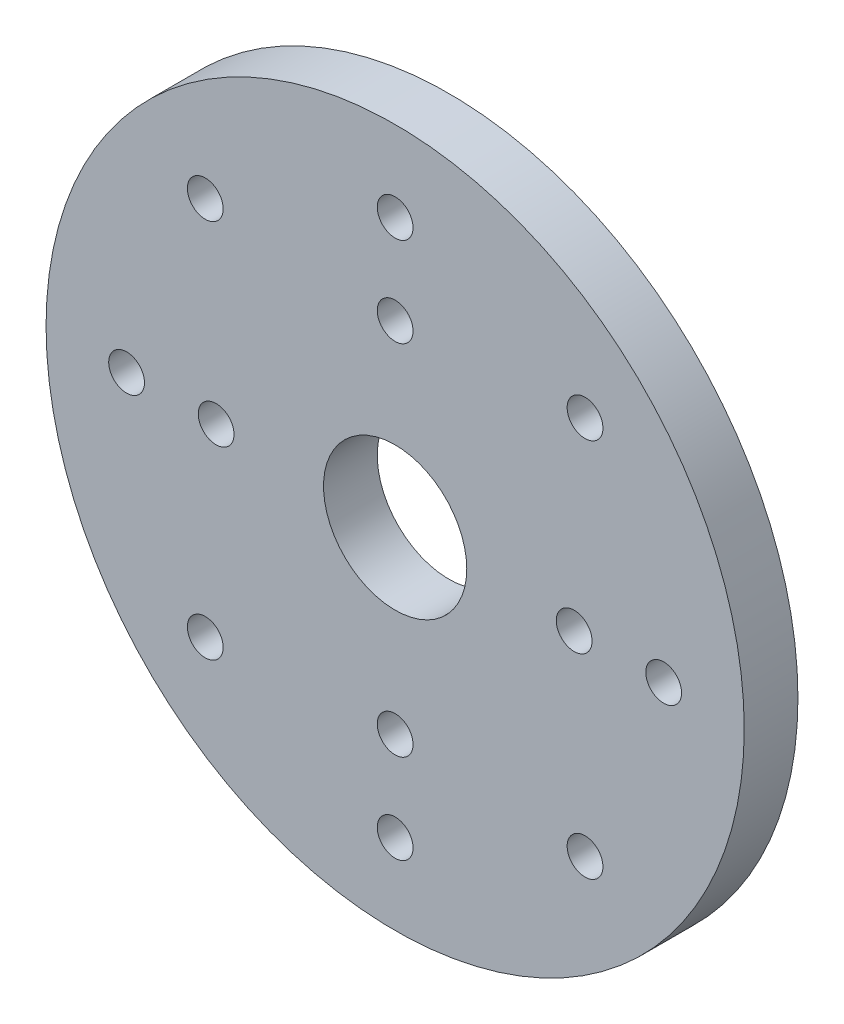
from build123d import *

# Parameters (mm, degrees)
CROQUIS1_R              = 19.5
SALIENTE_EXTRUIR1_DEPTH = 3
CROQUIS2_R              = 1
CORTAR_EXTRUIR1_DEPTH   = 3
CROQUIS3_R              = 4
CORTAR_EXTRUIR2_DEPTH   = 3


with BuildPart() as part:
    # Croquis1 → Saliente-Extruir1 (new body)
    with BuildSketch(Plane.XY):
        Circle(CROQUIS1_R)
    extrude(amount=SALIENTE_EXTRUIR1_DEPTH)

    # Croquis2 → Cortar-Extruir1 (cut)
    with BuildSketch(Plane.XY.offset(3)):
        with Locations((0, 10)):
            Circle(CROQUIS2_R)
        with Locations((10, 0)):
            Circle(CROQUIS2_R)
        with Locations((0, -10)):
            Circle(CROQUIS2_R)
        with Locations((-10, 0)):
            Circle(CROQUIS2_R)
        with Locations((0, 15)):
            Circle(CROQUIS2_R)
        with Locations((10.606601718, 10.606601718)):
            Circle(CROQUIS2_R)
        with Locations((15, 0)):
            Circle(CROQUIS2_R)
        with Locations((10.606601718, -10.606601718)):
            Circle(CROQUIS2_R)
        with Locations((0, -15)):
            Circle(CROQUIS2_R)
        with Locations((-10.606601718, -10.606601718)):
            Circle(CROQUIS2_R)
        with Locations((-15, 0)):
            Circle(CROQUIS2_R)
        with Locations((-10.606601718, 10.606601718)):
            Circle(CROQUIS2_R)
    extrude(amount=-CORTAR_EXTRUIR1_DEPTH, mode=Mode.SUBTRACT)

    # Croquis3 → Cortar-Extruir2 (cut)
    with BuildSketch(Plane.XY.offset(3)):
        Circle(CROQUIS3_R)
    extrude(amount=-CORTAR_EXTRUIR2_DEPTH, mode=Mode.SUBTRACT)


solid = part.part
